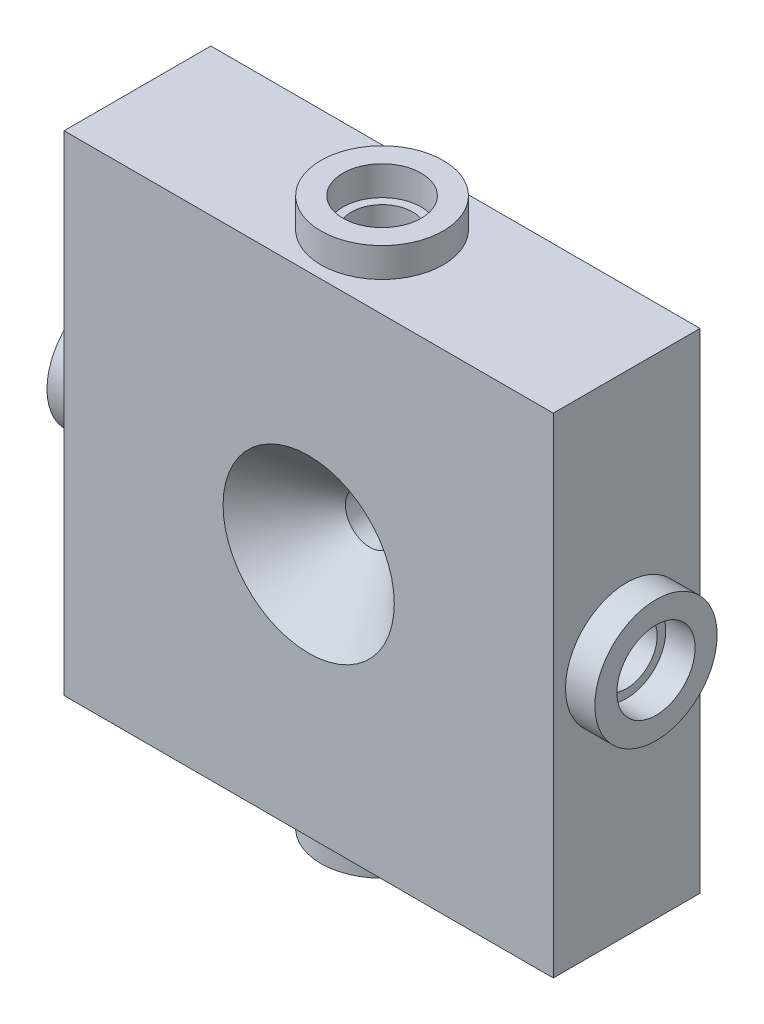
from build123d import *

# Parameters (mm, degrees)
SKETCH_1_W               = 20
SKETCH_1_H               = 20
SKETCH_1_R               = 1
EXTRUDE_1_DEPTH          = 3
PATTERN_CIRCULAR_1_COUNT = 4
SKETCH_6_R               = 2.5
SKETCH_6_R_2             = 1.6
EXTRUDE_2_DEPTH          = 1.2
PATTERN_CIRCULAR_2_COUNT = 4


with BuildPart() as part:
    # ｽｹｯﾁ1 → ﾎﾞｽ - 押し出し1 (new body)
    with BuildSketch(Plane.XY):
        Rectangle(SKETCH_1_W, SKETCH_1_H)
        Circle(SKETCH_1_R, mode=Mode.SUBTRACT)
    extrude(amount=EXTRUDE_1_DEPTH)

    # ｽｹｯﾁ2 → ｶｯﾄ - 回転1 (revolve, cut)
    with BuildSketch(Plane(origin=(0, 0, 0), x_dir=(1, 0, 0), z_dir=(0, 1, 0))):
        Polygon((1, -0.5), (0, -0.5), (0, -3), (3.5, -3), align=None)
    revolve(axis=Axis((0, 0, 0.5), (0, 0, 1)), mode=Mode.SUBTRACT)

    # ﾐﾗｰ1: part across plane


with BuildPart() as part_1:
    add(part.part)
    add(part.part.mirror(Plane.XY))

    # ｽｹｯﾁ5 → M3x0.5 ねじ穴1 (revolve, cut)
    with BuildSketch(Plane(origin=(-10, 0, 0), x_dir=(0, 0, 1), z_dir=(0, 1, 0))):
        Polygon((0, 0), (0, 6.751075774), (1.25, 6), (1.25, 0), align=None)
    m3x0_5_1 = revolve(axis=Axis((-16.35, 0, 0), (1, 0, 0)), mode=Mode.SUBTRACT)

    # 円形ﾊﾟﾀｰﾝ1: M3x0.5 ねじ穴1 ×4 about axis
    pattern_circular_1_axis = Axis((0, 0, 3), (0, 0, -1))
    for i in range(1, PATTERN_CIRCULAR_1_COUNT):
        add(m3x0_5_1.rotate(pattern_circular_1_axis, i * 360 / PATTERN_CIRCULAR_1_COUNT), mode=Mode.SUBTRACT)


with BuildPart() as body_2:
    # ｽｹｯﾁ6 → ﾎﾞｽ - 押し出し2 (new body)
    with BuildSketch(Plane(origin=(0, 10, 0), x_dir=(1, 0, 0), z_dir=(0, 1, 0))):
        with Locations(Location((0, 0, 0), (0, 0, 270))):
            Circle(SKETCH_6_R)
        with Locations(Location((0, 0, 0), (0, 0, 270))):
            Circle(SKETCH_6_R_2, mode=Mode.SUBTRACT)
    extrude(amount=EXTRUDE_2_DEPTH)


with BuildPart() as pattern_circular_2_1:
    # 円形ﾊﾟﾀｰﾝ2: pattern copy
    add(body_2.part.rotate(Axis((0, 0, 0), (0, 0, 1)), 1 * 360 / PATTERN_CIRCULAR_2_COUNT))


with BuildPart() as pattern_circular_2_2:
    # 円形ﾊﾟﾀｰﾝ2: pattern copy
    add(body_2.part.rotate(Axis((0, 0, 0), (0, 0, 1)), 2 * 360 / PATTERN_CIRCULAR_2_COUNT))


with BuildPart() as pattern_circular_2_3:
    # 円形ﾊﾟﾀｰﾝ2: pattern copy
    add(body_2.part.rotate(Axis((0, 0, 0), (0, 0, 1)), 3 * 360 / PATTERN_CIRCULAR_2_COUNT))


solid = Compound([part_1.part, body_2.part, pattern_circular_2_1.part, pattern_circular_2_2.part, pattern_circular_2_3.part])
